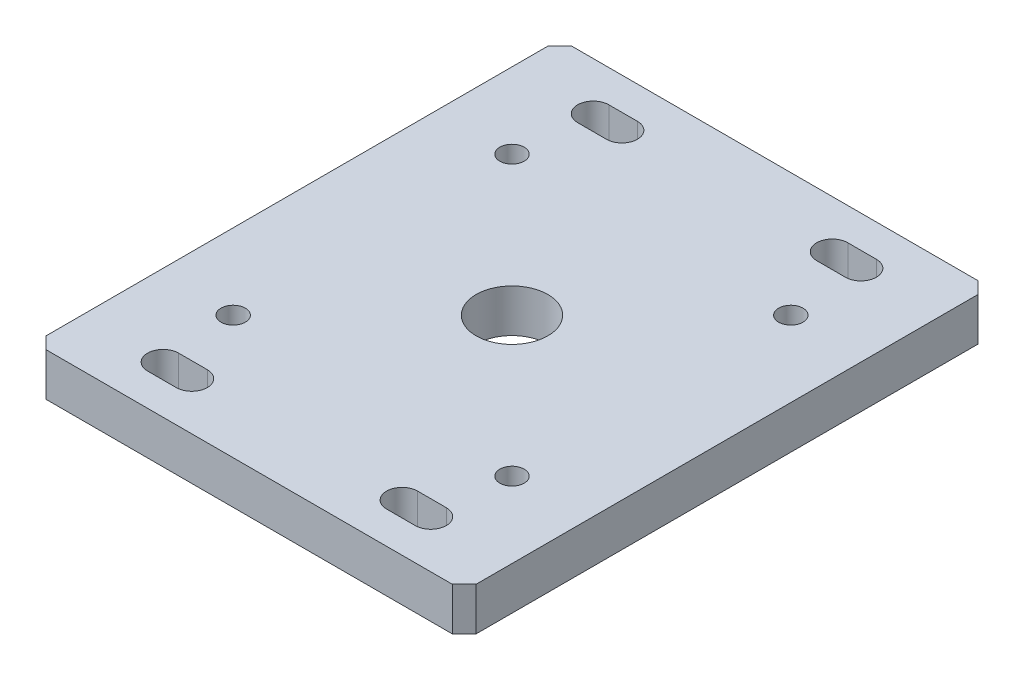
from build123d import *

# Parameters (mm, degrees)
SKETCH_1_W          = 220
SKETCH_1_H          = 18
EXTRUDE_1_DEPTH     = 90
CUT_EXTRUDE_1_REACH = 145.262
SKETCH_2_R          = 15
CHAMFER_1_SIZE      = 5
CUT_EXTRUDE_3_REACH = 145.262
HOLE_WIZARD_M12_1_D = 10.2


with BuildPart() as part:
    # 草圖1 → 伸長1 (new, symmetric)
    with BuildSketch(Plane(origin=(0, 0, 0), x_dir=(0, 0, -1), z_dir=(1, 0, 0))):
        with Locations((0, 9)):
            Rectangle(SKETCH_1_W, SKETCH_1_H)
    extrude(amount=EXTRUDE_1_DEPTH, both=True)

    # 草圖2 → 除料-伸長1 (cut, up to next)
    with BuildSketch(Plane.XZ, mode=Mode.PRIVATE) as cut_extrude_1_sk1:
        with Locations(Location((0, 0, 0), (0, 0, 270))):
            Circle(SKETCH_2_R)
    cut_extrude_1_tool1 = extrude(cut_extrude_1_sk1.sketch, amount=-CUT_EXTRUDE_1_REACH, mode=Mode.PRIVATE) & part.part
    add(cut_extrude_1_tool1.solids().sort_by_distance((0, 0, 0))[0], mode=Mode.SUBTRACT)

    # 導角1
    chamfer_1_edges = [part.edges().sort_by_distance(p)[0] for p in [
        (90, 9, 110),
        (90, 9, -110),
        (-90, 9, 110),
        (-90, 9, -110),
    ]]
    chamfer(chamfer_1_edges, length=CHAMFER_1_SIZE)

    # 草圖4 → 除料-伸長3 (cut, up to next)
    with BuildSketch(Plane.XZ, mode=Mode.PRIVATE) as cut_extrude_3_sk1:
        with BuildLine():
            Line((44, 83.5), (56, 83.5))
            ThreePointArc((56, 83.5), (62.5, 90), (56, 96.5))
            Line((56, 96.5), (44, 96.5))
            ThreePointArc((44, 96.5), (37.5, 90), (44, 83.5))
        make_face()
    cut_extrude_3_tool1 = extrude(cut_extrude_3_sk1.sketch, amount=-CUT_EXTRUDE_3_REACH, mode=Mode.PRIVATE) & part.part
    # 草圖4 → 除料-伸長3 (cut, up to next)
    with BuildSketch(Plane.XZ, mode=Mode.PRIVATE) as cut_extrude_3_sk2:
        with BuildLine():
            Line((-56, 83.5), (-44, 83.5))
            ThreePointArc((-44, 83.5), (-37.5, 90), (-44, 96.5))
            Line((-44, 96.5), (-56, 96.5))
            ThreePointArc((-56, 96.5), (-62.5, 90), (-56, 83.5))
        make_face()
    cut_extrude_3_tool2 = extrude(cut_extrude_3_sk2.sketch, amount=-CUT_EXTRUDE_3_REACH, mode=Mode.PRIVATE) & part.part
    # 草圖4 → 除料-伸長3 (cut, up to next)
    with BuildSketch(Plane.XZ, mode=Mode.PRIVATE) as cut_extrude_3_sk3:
        with BuildLine():
            Line((-56, -96.5), (-44, -96.5))
            ThreePointArc((-44, -96.5), (-37.5, -90), (-44, -83.5))
            Line((-44, -83.5), (-56, -83.5))
            ThreePointArc((-56, -83.5), (-62.5, -90), (-56, -96.5))
        make_face()
    cut_extrude_3_tool3 = extrude(cut_extrude_3_sk3.sketch, amount=-CUT_EXTRUDE_3_REACH, mode=Mode.PRIVATE) & part.part
    # 草圖4 → 除料-伸長3 (cut, up to next)
    with BuildSketch(Plane.XZ, mode=Mode.PRIVATE) as cut_extrude_3_sk4:
        with BuildLine():
            Line((44, -96.5), (56, -96.5))
            ThreePointArc((56, -96.5), (62.5, -90), (56, -83.5))
            Line((56, -83.5), (44, -83.5))
            ThreePointArc((44, -83.5), (37.5, -90), (44, -96.5))
        make_face()
    cut_extrude_3_tool4 = extrude(cut_extrude_3_sk4.sketch, amount=-CUT_EXTRUDE_3_REACH, mode=Mode.PRIVATE) & part.part
    add(cut_extrude_3_tool1.solids().sort_by_distance((50, 0, 90))[0], mode=Mode.SUBTRACT)
    add(cut_extrude_3_tool2.solids().sort_by_distance((-50, 0, 90))[0], mode=Mode.SUBTRACT)
    add(cut_extrude_3_tool3.solids().sort_by_distance((-50, 0, -90))[0], mode=Mode.SUBTRACT)
    add(cut_extrude_3_tool4.solids().sort_by_distance((50, 0, -90))[0], mode=Mode.SUBTRACT)

    # M12 螺紋孔1 (through all)
    with Locations(Plane(origin=(0, 18, 0), x_dir=(-1, 0, 0), z_dir=(0, 1, 0))):
        with Locations((58.336309448, 58.336309448), (58.336309448, -58.336309448), (-58.336309448, -58.336309448), (-58.336309448, 58.336309448)):
            Hole(HOLE_WIZARD_M12_1_D / 2)


solid = part.part
